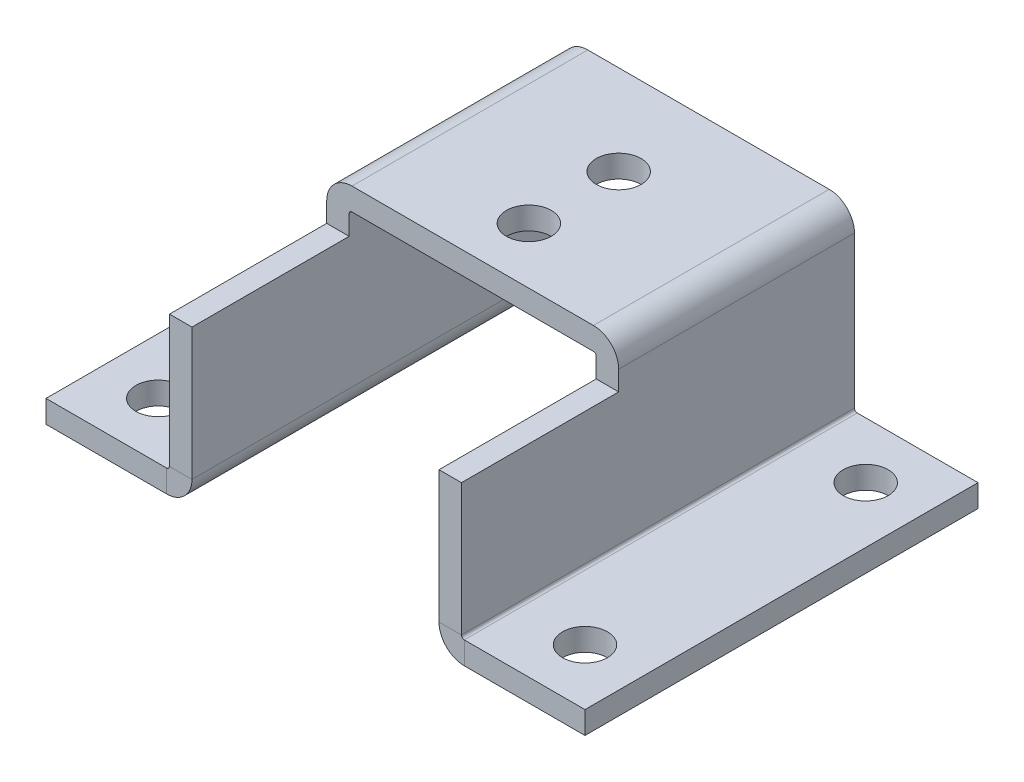
from build123d import *

# Parameters (mm, degrees)
SKETCH2_W               = 35
SKETCH2_H               = 2
CUT_EXTRUDE1_DEPTH      = 35.223529917
CUT_EXTRUDE1_DEPTH_BACK = 35.223529917
SKETCH3_W               = 14
SKETCH3_H               = 4
CUT_EXTRUDE2_DEPTH      = 35.731109974
CUT_EXTRUDE2_DEPTH_BACK = 35.731109974
SKETCH4_R               = 2


with BuildPart() as part:
    # Sweep1: sweep along a path in Sketch1
    with BuildLine(Plane.XY) as sweep1_path:
        Line((24, -16), (13.25, -16))
        ThreePointArc((13.25, -16), (12.366116524, -15.633883476), (12, -14.75))
        Line((12, -14.75), (12, -1.25))
        ThreePointArc((12, -1.25), (11.633883476, -0.366116524), (10.75, 0))
        Line((10.75, 0), (-10.75, 0))
        ThreePointArc((-10.75, 0), (-11.633883476, -0.366116524), (-12, -1.25))
        Line((-12, -1.25), (-12, -14.75))
        ThreePointArc((-12, -14.75), (-12.366116524, -15.633883476), (-13.25, -16))
        Line((-13.25, -16), (-24, -16))
    # Sketch2 → Sweep1 (sweep)
    with BuildSketch(Plane(origin=(0, 0, 0), x_dir=(0, 0, -1), z_dir=(1, 0, 0))):
        Rectangle(SKETCH2_W, SKETCH2_H)
    sweep(path=sweep1_path.line)

    # Sketch3 → Cut-Extrude1 (cut, two sides: drawn at the far end of the back side and taken through both)
    with BuildSketch(Plane(origin=(0, 0, 0), x_dir=(0, 0, -1), z_dir=(1, 0, 0)).offset(-CUT_EXTRUDE1_DEPTH_BACK)):
        with Locations((-10.5, -1)):
            Rectangle(SKETCH3_W, SKETCH3_H)
    extrude(amount=CUT_EXTRUDE1_DEPTH + CUT_EXTRUDE1_DEPTH_BACK, mode=Mode.SUBTRACT)

    # Sketch4 → Cut-Extrude2 (cut, two sides: drawn at the far end of the back side and taken through both)
    with BuildSketch(Plane(origin=(0, 1, 0), x_dir=(1, 0, 0), z_dir=(0, 1, 0)).offset(-CUT_EXTRUDE2_DEPTH_BACK)):
        with Locations(Location((0, 1.5, 0), (0, 0, 180))):
            Circle(SKETCH4_R)
        with Locations(Location((0, 9.5, 0), (0, 0, 180))):
            Circle(SKETCH4_R)
        with Locations(Location((-19, 12.5, 0), (0, 0, 180))):
            Circle(SKETCH4_R)
        with Locations(Location((-19, -12.5, 0), (0, 0, 180))):
            Circle(SKETCH4_R)
        with Locations(Location((19, -12.5, 0), (0, 0, 180))):
            Circle(SKETCH4_R)
        with Locations(Location((19, 12.5, 0), (0, 0, 180))):
            Circle(SKETCH4_R)
    extrude(amount=CUT_EXTRUDE2_DEPTH + CUT_EXTRUDE2_DEPTH_BACK, mode=Mode.SUBTRACT)


solid = part.part
